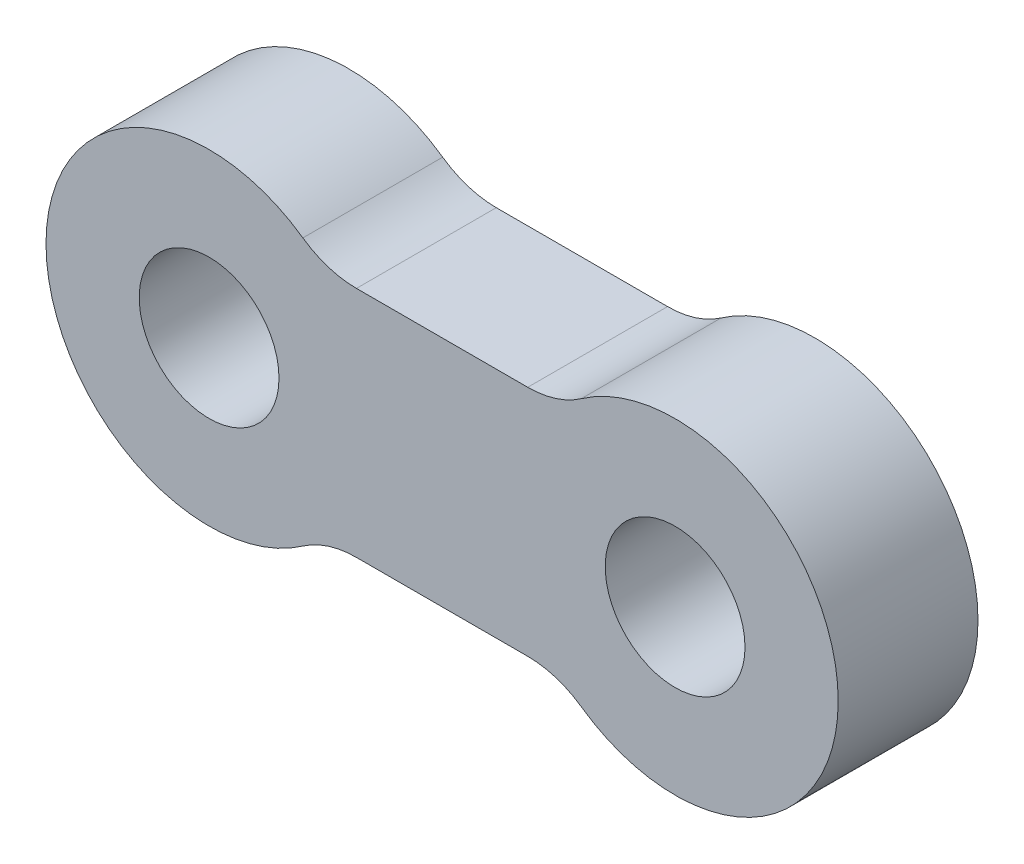
from build123d import *
from build123d.topology import SkipClean

# Parameters (mm, degrees)
SKETCH_1_R          = 1.5
EXTRUDE_1_DEPTH     = 3
CUT_EXTRUDE_1_DEPTH = 15.265342618


with BuildPart() as part:
    # 草图1 → 凸台-拉伸1 (new body)
    with BuildSketch(Plane.XY):
        with BuildLine():
            Line((0, 3.5), (10, 3.5))
            ThreePointArc((10, 3.5), (13.5, 0), (10, -3.5))
            Line((10, -3.5), (0, -3.5))
            ThreePointArc((0, -3.5), (-3.5, 0), (0, 3.5))
        make_face()
        Circle(SKETCH_1_R, mode=Mode.SUBTRACT)
        with Locations((10, 0)):
            Circle(SKETCH_1_R, mode=Mode.SUBTRACT)
    extrude(amount=EXTRUDE_1_DEPTH)

    # 草图2 → 切除-拉伸1 (cut, through all)
    with SkipClean():  # the faces are left unmerged after this step: merging them gives an invalid solid
        with BuildSketch(Plane.XY.offset(3)):
            with BuildLine():
                Line((3.16227766, 2.5), (6.83772234, 2.5))
                ThreePointArc((6.83772234, 2.5), (7.440745029, 2.593074822), (7.987641489, 2.863636364))
                ThreePointArc((7.987641489, 2.863636364), (8.944710294, 3.337119062), (10, 3.5))
                Line((10, 3.5), (0, 3.5))
                ThreePointArc((0, 3.5), (1.055289706, 3.337119062), (2.012358511, 2.863636364))
                ThreePointArc((2.012358511, 2.863636364), (2.559254971, 2.593074822), (3.16227766, 2.5))
            make_face()
            with BuildLine():
                Line((3.16227766, -2.5), (6.83772234, -2.5))
                ThreePointArc((6.83772234, -2.5), (7.440745029, -2.593074822), (7.987641489, -2.863636364))
                ThreePointArc((7.987641489, -2.863636364), (8.944710294, -3.337119062), (10, -3.5))
                Line((10, -3.5), (0, -3.5))
                ThreePointArc((0, -3.5), (1.055289706, -3.337119062), (2.012358511, -2.863636364))
                ThreePointArc((2.012358511, -2.863636364), (2.559254971, -2.593074822), (3.16227766, -2.5))
            make_face()
        extrude(amount=-CUT_EXTRUDE_1_DEPTH, mode=Mode.SUBTRACT)


solid = part.part
